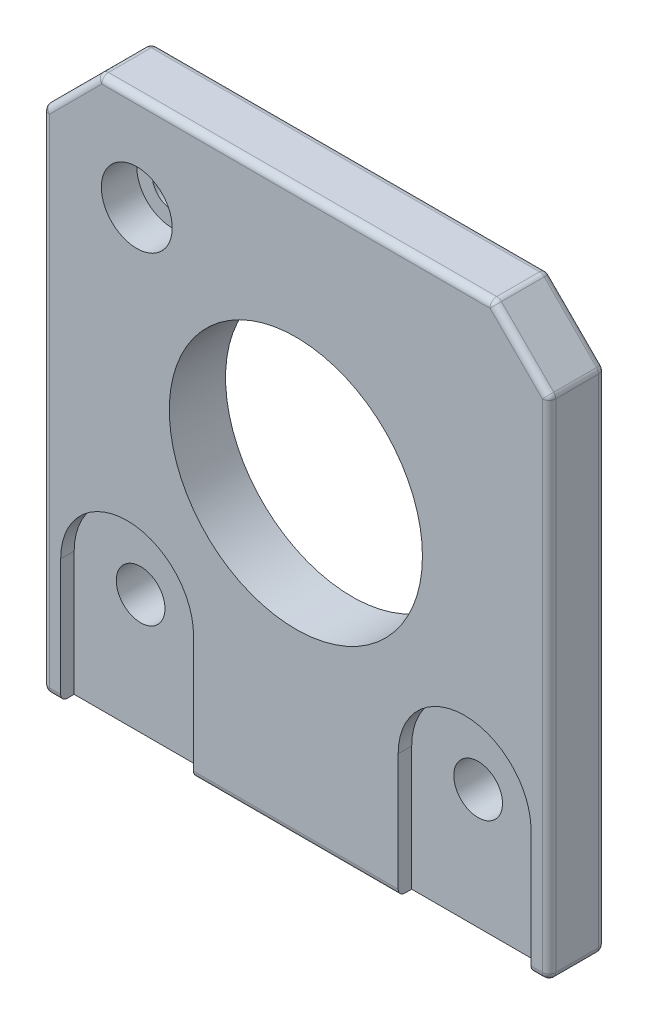
from build123d import *

# Parameters (mm, degrees)
SKETCH2_W                      = 57.15
SKETCH2_H                      = 6.35
BOSS_EXTRUDE1_DEPTH            = 63.5
SKETCH3_R                      = 14.2875
CUT_EXTRUDE1_DEPTH             = 70.922121857
CHAMFER1_SIZE                  = 6.35
M5_CLEARANCE_HOLE1_D           = 5.5
FILLET1_R                      = 0.762
CUT_EXTRUDE4_DEPTH             = 1.524
CBORE_FOR_M4_SHCS2_D           = 4.5
CBORE_FOR_M4_SHCS2_CBORE_D     = 8
CBORE_FOR_M4_SHCS2_CBORE_DEPTH = 4


with BuildPart() as part:
    # Sketch2 → Boss-Extrude1 (new body)
    with BuildSketch(Plane(origin=(0, 0, 0), x_dir=(1, 0, 0), z_dir=(0, 1, 0))):
        Rectangle(SKETCH2_W, SKETCH2_H)
    extrude(amount=-BOSS_EXTRUDE1_DEPTH)

    # Sketch3 → Cut-Extrude1 (cut, through all)
    with BuildSketch(Plane.XY.offset(3.175)):
        with Locations((0, -28.8150046)):
            Circle(SKETCH3_R)
    extrude(amount=-CUT_EXTRUDE1_DEPTH, mode=Mode.SUBTRACT)

    # Chamfer1
    chamfer1_edges = [part.edges().sort_by_distance(p)[0] for p in [
        (28.575, 0, 0),
        (-28.575, 0, 0),
    ]]
    chamfer(chamfer1_edges, length=CHAMFER1_SIZE)

    # M5 Clearance Hole1 (through all)
    with Locations(Plane.XY.offset(3.175)):
        with Locations((-19.05, -50.000003124), (19.05, -50.000003124)):
            Hole(M5_CLEARANCE_HOLE1_D / 2)

    # Fillet1
    fillet1_edges = [part.edges().sort_by_distance(p)[0] for p in [
        (28.575, -63.5, 0),
        (0, -63.5, -3.175),
        (0, 0, 3.175),
        (0, 0, -3.175),
        (22.225, 0, 0),
        (-22.225, 0, 0),
        (25.4, -3.175, 3.175),
        (-25.4, -3.175, 3.175),
        (-28.575, -6.35, 0),
        (25.4, -3.175, -3.175),
        (-25.4, -3.175, -3.175),
        (28.575, -6.35, 0),
        (-28.575, -63.5, 0),
        (-28.575, -34.925, -3.175),
        (28.575, -34.925, -3.175),
        (28.575, -34.925, 3.175),
        (-28.575, -34.925, 3.175),
        (0, -63.5, 3.175),
    ]]
    fillet(fillet1_edges, radius=FILLET1_R)

    # Sketch8 → Cut-Extrude4 (cut)
    with BuildSketch(Plane.XY.offset(3.175)):
        with BuildLine():
            Line((11.55, -63.5), (11.55, -49.5))
            ThreePointArc((11.55, -49.5), (19.05, -42), (26.55, -49.5))
            Line((26.55, -49.5), (26.55, -63.5))
            Line((26.55, -63.5), (11.55, -63.5))
        make_face()
    cut_extrude4 = extrude(amount=-CUT_EXTRUDE4_DEPTH, mode=Mode.SUBTRACT)

    # Mirror1: Cut-Extrude4 across plane
    add(cut_extrude4.mirror(Plane(origin=(0, 0, 0), x_dir=(0, 0, 1), z_dir=(1, 0, 0))), mode=Mode.SUBTRACT)

    # CBORE for M4 SHCS2 (through all)
    with Locations(Plane.XY.offset(3.175)):
        with Locations((-17.9605178, -10.8544868)):
            CounterBoreHole(CBORE_FOR_M4_SHCS2_D / 2, CBORE_FOR_M4_SHCS2_CBORE_D / 2, CBORE_FOR_M4_SHCS2_CBORE_DEPTH)


solid = part.part
